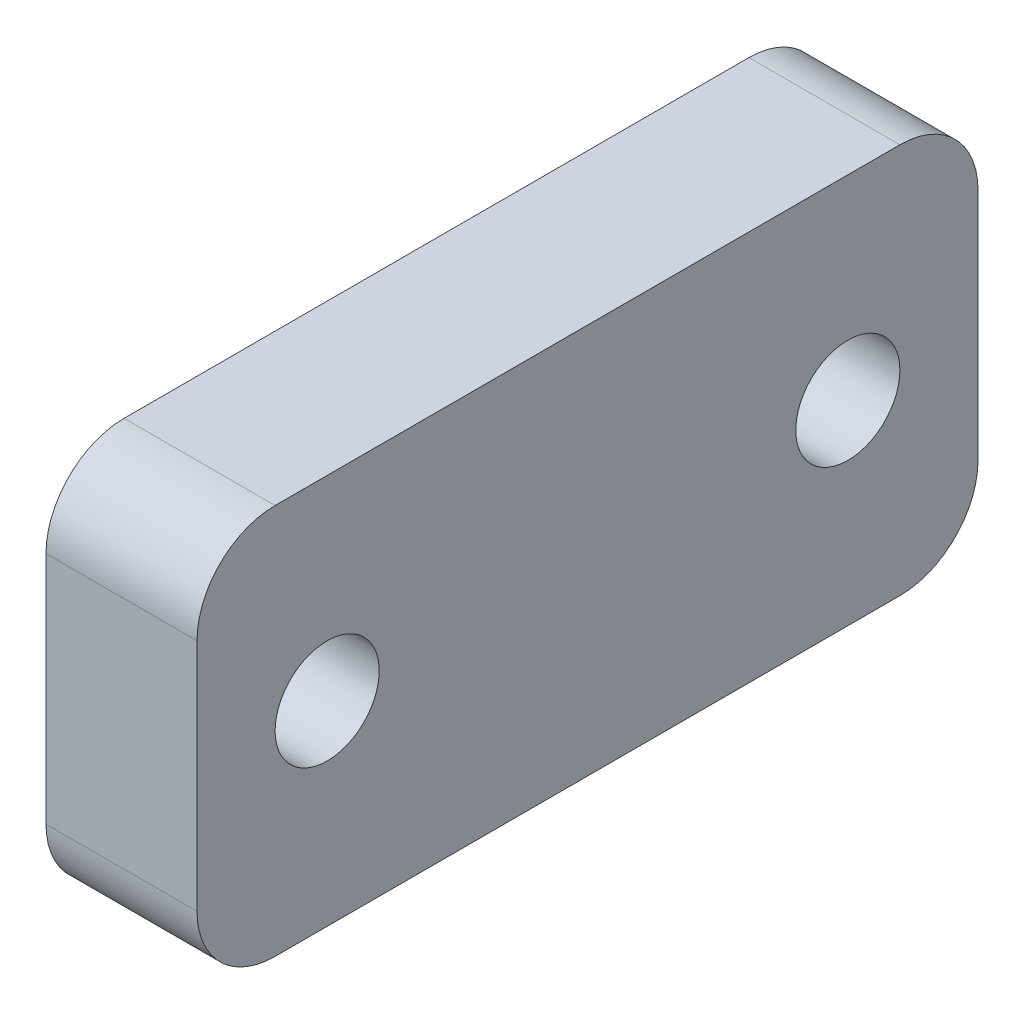
from build123d import *

# Parameters (mm, degrees)
SKETCH_1_W      = 30
SKETCH_1_H      = 15
SKETCH_1_R      = 2
EXTRUDE_1_DEPTH = 5.8
FILLET_1_R      = 3


with BuildPart() as part:
    # ｽｹｯﾁ1 → ﾎﾞｽ - 押し出し1 (new body)
    with BuildSketch(Plane(origin=(0, 0, 0), x_dir=(0, 0, -1), z_dir=(1, 0, 0))):
        Rectangle(SKETCH_1_W, SKETCH_1_H)
        with Locations((10, 0)):
            Circle(SKETCH_1_R, mode=Mode.SUBTRACT)
        with Locations(Location((-10, 0, 0), (0, 0, 180))):
            Circle(SKETCH_1_R, mode=Mode.SUBTRACT)
    extrude(amount=EXTRUDE_1_DEPTH)

    # ﾌｨﾚｯﾄ1
    fillet_1_edges = [part.edges().sort_by_distance(p)[0] for p in [
        (2.9, -7.5, -15),
        (2.9, -7.5, 15),
        (2.9, 7.5, 15),
        (2.9, 7.5, -15),
    ]]
    fillet(fillet_1_edges, radius=FILLET_1_R)


solid = part.part
